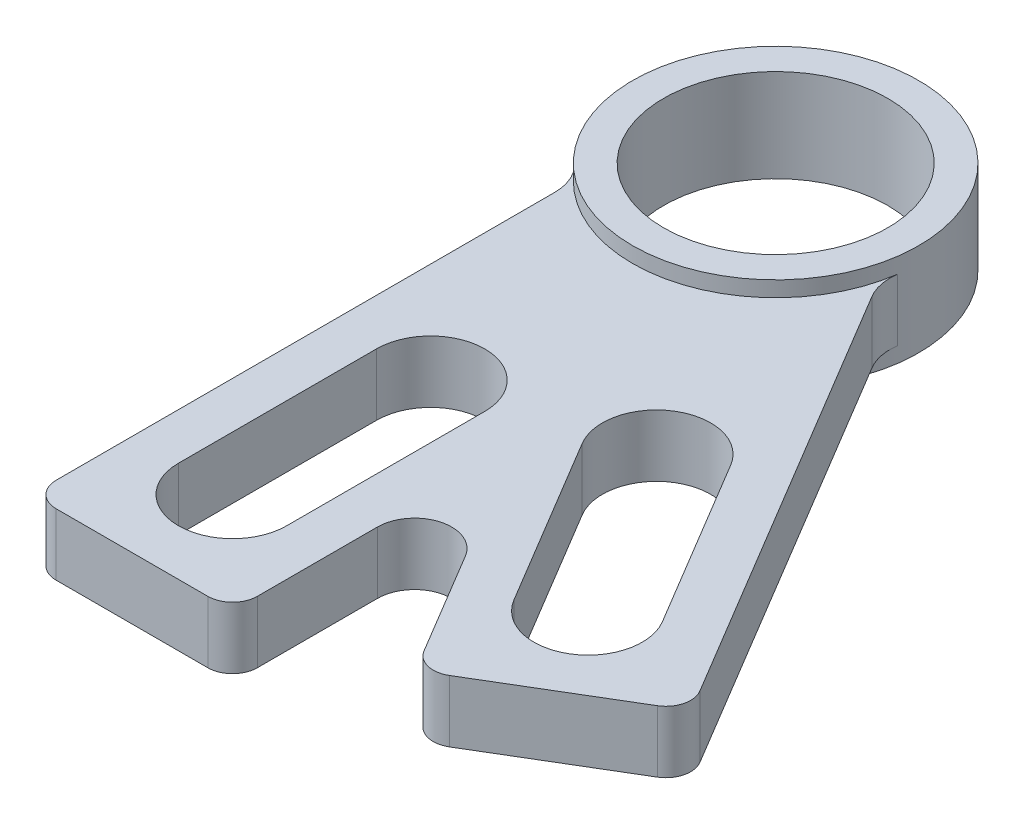
from build123d import *

# Parameters (mm, degrees)
SKETCH1_R                      = 14.6812
SKETCH1_R_2                    = 11.5062
BEARING_INSERT_EXTRUDE_DEPTH   = 4.7625
APEX_SLOT_INSERT_EXTRUDE_DEPTH = 3.175
FILLET1_R                      = 5.08
FILLET2_R                      = 2.54
FILLET3_R                      = 3.81


with BuildPart() as part:
    # Sketch1 → Bearing_Insert_Extrude (new, symmetric)
    with BuildSketch(Plane(origin=(0, 0, 0), x_dir=(1, 0, 0), z_dir=(0, 1, 0))):
        with Locations(Location((0, 0, 0), (0, 0, 90))):
            Circle(SKETCH1_R)
        with Locations(Location((0, 0, 0), (0, 0, 90))):
            Circle(SKETCH1_R_2, mode=Mode.SUBTRACT)
    extrude(amount=BEARING_INSERT_EXTRUDE_DEPTH, both=True)

    # Sketch1<4> → Apex_Slot_Insert_Extrude (add, symmetric)
    # profile 1 of 2: a face of its own
    with BuildSketch(Plane(origin=(0, 0, 0), x_dir=(1, 0, 0), z_dir=(0, 1, 0))):
        with BuildLine():
            Line((-10.31875, -10.443228997), (-10.31875, -66.04))
            Line((-10.31875, -66.04), (10.31875, -66.04))
            Line((10.31875, -66.04), (10.31875, -37.376828003))
            Line((10.31875, -37.376828003), (25.024230745, -61.980207141))
            Line((25.024230745, -61.980207141), (42.738677597, -51.392252712))
            Line((42.738677597, -51.392252712), (14.215063896, -3.670094259))
            ThreePointArc((14.215063896, -3.670094259), (3.906936657, -14.151801278), (-10.31875, -10.443228997))
        make_face()
        with BuildLine():
            ThreePointArc((5.55625, -55.72125), (0, -61.2775), (-5.55625, -55.72125))
            Line((-5.55625, -55.72125), (-5.55625, -35.40125))
            ThreePointArc((-5.55625, -35.40125), (0, -29.845), (5.55625, -35.40125))
            Line((5.55625, -35.40125), (5.55625, -55.72125))
        make_face(mode=Mode.SUBTRACT)
        with BuildLine():
            ThreePointArc((33.356751109, -44.978403385), (31.438080072, -52.598280653), (23.818202804, -50.679609616))
            Line((23.818202804, -50.679609616), (13.393139982, -33.237692715))
            ThreePointArc((13.393139982, -33.237692715), (15.31181102, -25.617815447), (22.931688287, -27.536486485))
            Line((22.931688287, -27.536486485), (33.356751109, -44.978403385))
        make_face(mode=Mode.SUBTRACT)
    # profile 2 of 2: a face of its own
    with BuildSketch(Plane(origin=(0, 0, 0), x_dir=(1, 0, 0), z_dir=(0, 1, 0))):
        with BuildLine():
            Line((-10.31875, -10.443228997), (-10.31875, -66.04))
            Line((-10.31875, -66.04), (10.31875, -66.04))
            Line((10.31875, -66.04), (10.31875, -37.376828003))
            Line((10.31875, -37.376828003), (25.024230745, -61.980207141))
            Line((25.024230745, -61.980207141), (42.738677597, -51.392252712))
            Line((42.738677597, -51.392252712), (14.215063896, -3.670094259))
            ThreePointArc((14.215063896, -3.670094259), (3.906936657, -14.151801278), (-10.31875, -10.443228997))
        make_face()
        with BuildLine():
            ThreePointArc((5.55625, -55.72125), (0, -61.2775), (-5.55625, -55.72125))
            Line((-5.55625, -55.72125), (-5.55625, -35.40125))
            ThreePointArc((-5.55625, -35.40125), (0, -29.845), (5.55625, -35.40125))
            Line((5.55625, -35.40125), (5.55625, -55.72125))
        make_face(mode=Mode.SUBTRACT)
        with BuildLine():
            ThreePointArc((33.356751109, -44.978403385), (31.438080072, -52.598280653), (23.818202804, -50.679609616))
            Line((23.818202804, -50.679609616), (13.393139982, -33.237692715))
            ThreePointArc((13.393139982, -33.237692715), (15.31181102, -25.617815447), (22.931688287, -27.536486485))
            Line((22.931688287, -27.536486485), (33.356751109, -44.978403385))
        make_face(mode=Mode.SUBTRACT)
    extrude(amount=APEX_SLOT_INSERT_EXTRUDE_DEPTH, both=True)

    # Fillet1
    fillet1_edges = [part.edges().sort_by_distance(p)[0] for p in [
        (14.215063896, 0, 3.670094259),
        (-10.31875, 0, 10.443228997),
    ]]
    fillet(fillet1_edges, radius=FILLET1_R)

    # Fillet2
    fillet2_edges = [part.edges().sort_by_distance(p)[0] for p in [
        (-10.31875, 0, 66.04),
        (10.31875, 0, 66.04),
        (25.024230745, 0, 61.980207141),
        (42.738677597, 0, 51.392252712),
    ]]
    fillet(fillet2_edges, radius=FILLET2_R)

    # Fillet3
    fillet3_edges = [part.edges().sort_by_distance(p)[0] for p in [
        (10.31875, 0, 37.376828003),
    ]]
    fillet(fillet3_edges, radius=FILLET3_R)


solid = part.part
